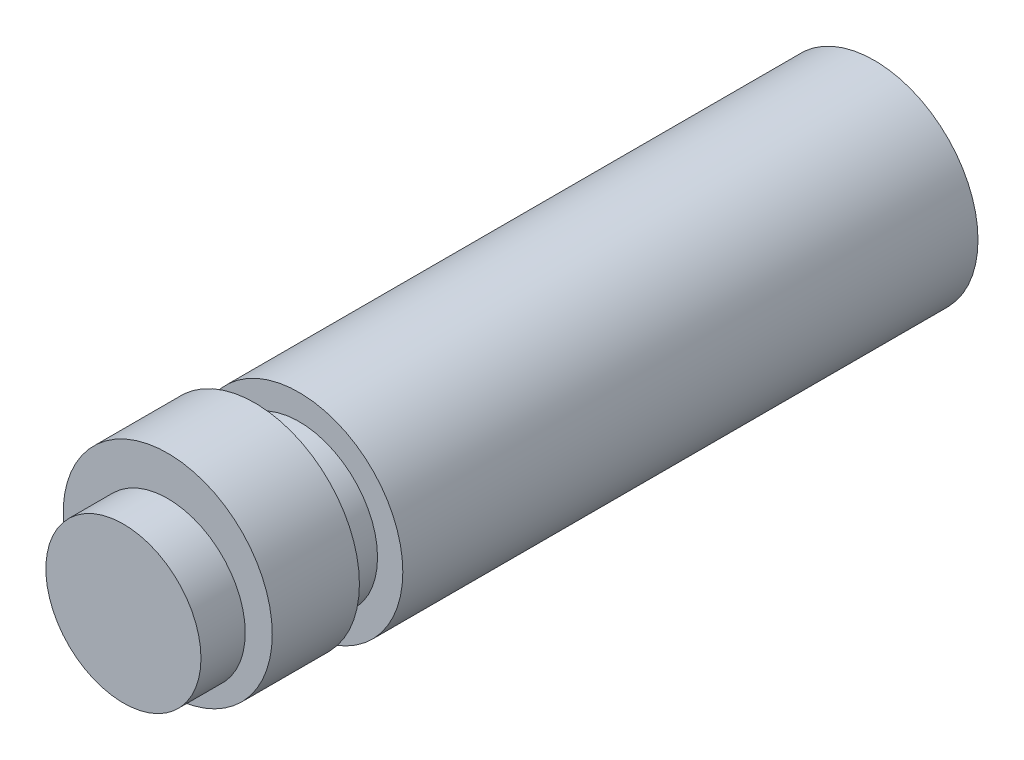
from build123d import *

# Parameters (mm, degrees)
SKETCH1_R           = 5.95
BOSS_EXTRUDE1_DEPTH = 33
SKETCH7_R           = 4.5
BOSS_EXTRUDE7_DEPTH = 2.54
SKETCH3_R           = 6
BOSS_EXTRUDE3_DEPTH = 5
SKETCH4_R           = 4.45
BOSS_EXTRUDE4_DEPTH = 2.54
CUT_EXTRUDE1_DEPTH  = 31.5


with BuildPart() as part:
    # Sketch1 → Boss-Extrude1 (new body)
    with BuildSketch(Plane.XY):
        Circle(SKETCH1_R)
    extrude(amount=BOSS_EXTRUDE1_DEPTH)

    # Sketch7 → Boss-Extrude7 (add)
    with BuildSketch(Plane.XY.offset(33)):
        Circle(SKETCH7_R)
    extrude(amount=BOSS_EXTRUDE7_DEPTH)

    # Sketch3 → Boss-Extrude3 (add)
    with BuildSketch(Plane.XY.offset(35.54)):
        with Locations((0, 0.7)):
            Circle(SKETCH3_R)
    extrude(amount=BOSS_EXTRUDE3_DEPTH)

    # Sketch4 → Boss-Extrude4 (add)
    with BuildSketch(Plane.XY.offset(40.54)):
        Circle(SKETCH4_R)
    extrude(amount=BOSS_EXTRUDE4_DEPTH)

    # Sketch5 → Cut-Extrude1 (cut)
    with BuildSketch(Plane(origin=(0, 0, 0), x_dir=(-1, 0, 0), z_dir=(0, 0, -1))):
        with BuildLine():
            Line((-1.075, 5.09246155), (-1.075, 3.98246155))
            ThreePointArc((-1.075, 3.98246155), (0, 4.125), (1.075, 3.98246155))
            Line((1.075, 3.98246155), (1.075, 5.09246155))
            Line((1.075, 5.09246155), (-1.075, 5.09246155))
        make_face()
        with BuildLine():
            ThreePointArc((1.075, 3.98246155), (0, 4.125), (-1.075, 3.98246155))
            Line((-1.075, 3.98246155), (1.075, 3.98246155))
        make_face()
        with BuildLine():
            Line((1.075, 3.98246155), (-1.075, 3.98246155))
            ThreePointArc((-1.075, 3.98246155), (-2.50811184, -3.274904579), (4.125, 0))
            ThreePointArc((4.125, 0), (3.274904579, 2.50811184), (1.075, 3.98246155))
        make_face()
    extrude(amount=-CUT_EXTRUDE1_DEPTH, mode=Mode.SUBTRACT)


solid = part.part
